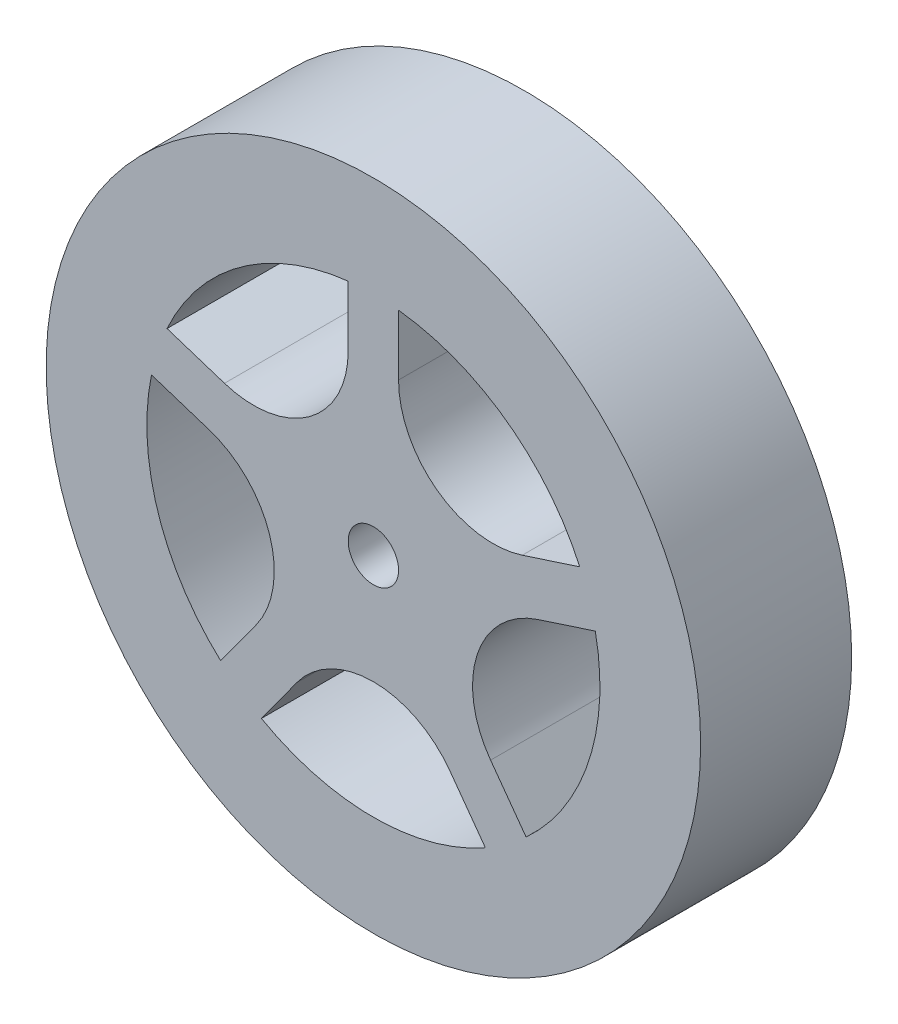
from build123d import *

# Parameters (mm, degrees)
SKETCH_1_R      = 32.5
SKETCH_1_R_2    = 2.5
EXTRUDE_1_DEPTH = 15


with BuildPart() as part:
    # 草圖1 → 填料-伸長1 (new body)
    with BuildSketch(Plane.XY):
        Circle(SKETCH_1_R)
        Circle(SKETCH_1_R_2, mode=Mode.SUBTRACT)
        with BuildLine():
            Line((-2.5, 22.360679775), (-2.5, 16.360679775))
            ThreePointArc((-2.5, 16.360679775), (-6.369348392, 8.766655972), (-14.787388625, 7.433369381))
            Line((-14.787388625, 7.433369381), (-20.493727723, 9.287471347))
            ThreePointArc((-20.493727723, 9.287471347), (-13.225168177, 18.202882373), (-2.5, 22.360679775))
        make_face(mode=Mode.SUBTRACT)
        with BuildLine():
            Line((2.5, 22.360679775), (2.5, 16.360679775))
            ThreePointArc((2.5, 16.360679775), (6.369348392, 8.766655972), (14.787388625, 7.433369381))
            Line((14.787388625, 7.433369381), (20.493727723, 9.287471347))
            ThreePointArc((20.493727723, 9.287471347), (13.225168177, 18.202882373), (2.5, 22.360679775))
        make_face(mode=Mode.SUBTRACT)
        with BuildLine():
            Line((22.038812695, 4.532188766), (16.332473597, 2.678086799))
            ThreePointArc((16.332473597, 2.678086799), (10.305822184, -3.348564614), (11.639108775, -11.766604847))
            Line((11.639108775, -11.766604847), (15.165820289, -16.620706813))
            ThreePointArc((15.165820289, -16.620706813), (21.398771617, -6.952882373), (22.038812695, 4.532188766))
        make_face(mode=Mode.SUBTRACT)
        with BuildLine():
            Line((11.120735317, -19.559633074), (7.594023803, -14.705531108))
            ThreePointArc((7.594023803, -14.705531108), (0, -10.836182716), (-7.594023803, -14.705531108))
            Line((-7.594023803, -14.705531108), (-11.120735317, -19.559633074))
            ThreePointArc((-11.120735317, -19.559633074), (0, -22.5), (11.120735317, -19.559633074))
        make_face(mode=Mode.SUBTRACT)
        with BuildLine():
            Line((-15.165820289, -16.620706813), (-11.639108775, -11.766604847))
            ThreePointArc((-11.639108775, -11.766604847), (-10.305822184, -3.348564614), (-16.332473597, 2.678086799))
            Line((-16.332473597, 2.678086799), (-22.038812695, 4.532188766))
            ThreePointArc((-22.038812695, 4.532188766), (-21.398771617, -6.952882373), (-15.165820289, -16.620706813))
        make_face(mode=Mode.SUBTRACT)
    extrude(amount=EXTRUDE_1_DEPTH)


solid = part.part
